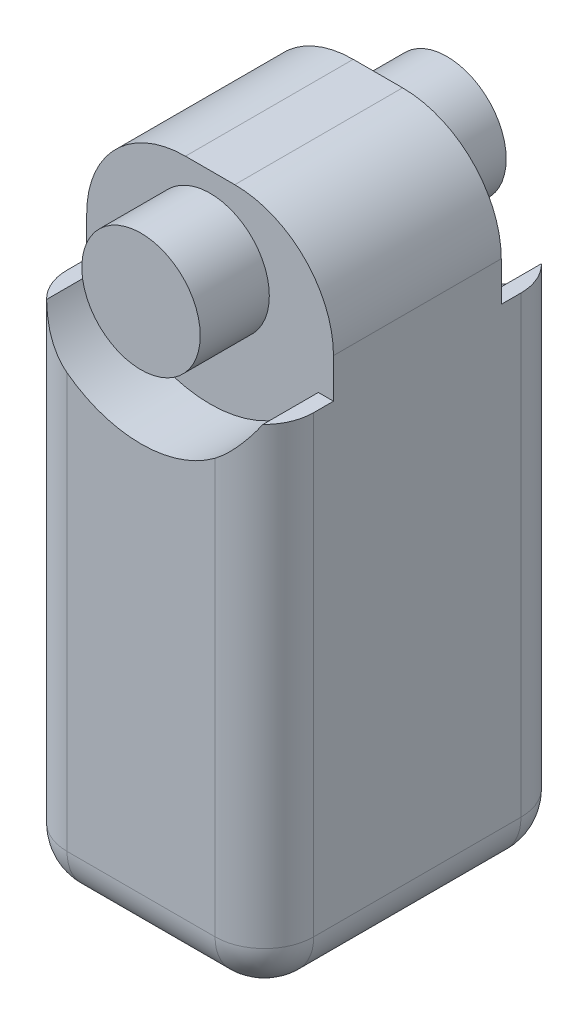
from build123d import *

# Parameters (mm, degrees)
CROQUIS1_W              = 25
CROQUIS1_H              = 65
SALIENTE_EXTRUIR1_DEPTH = 15.5
CROQUIS2_R              = 6
CORTAR_EXTRUIR1_DEPTH   = 7
REDONDEO1_R             = 10
REDONDEO2_R             = 5
CROQUIS3_R              = 5
CORTAR_EXTRUIR2_DEPTH   = 5.5
REDONDEO3_R             = 5


with BuildPart() as part:
    # Croquis1 → Saliente-Extruir1 (new, symmetric)
    with BuildSketch(Plane.XY):
        with Locations((10.230951989, -15.239848308)):
            Rectangle(CROQUIS1_W, CROQUIS1_H)
    extrude(amount=SALIENTE_EXTRUIR1_DEPTH, both=True)

    # Croquis2 → Cortar-Extruir1 (cut)
    with BuildSketch(Plane.XY.offset(15.5)):
        with BuildLine():
            Line((-2.269048011, 9.260151692), (-2.269048011, 26.058320898))
            Line((-2.269048011, 26.058320898), (22.730951989, 26.058320898))
            Line((22.730951989, 26.058320898), (22.730951989, 9.260151692))
            Line((22.730951989, 9.260151692), (22.730951989, 3.260151692))
            Line((22.730951989, 3.260151692), (21.196808088, 3.260151692))
            ThreePointArc((21.196808088, 3.260151692), (10.230951989, -3.239848308), (-0.734904111, 3.260151692))
            Line((-0.734904111, 3.260151692), (-2.269048011, 3.260151692))
            Line((-2.269048011, 3.260151692), (-2.269048011, 9.260151692))
        make_face()
        with Locations((10.230951989, 9.260151692)):
            Circle(CROQUIS2_R, mode=Mode.SUBTRACT)
    cortar_extruir1 = extrude(amount=-CORTAR_EXTRUIR1_DEPTH, mode=Mode.SUBTRACT)

    # Simetría1: Cortar-Extruir1 across plane
    add(cortar_extruir1.mirror(Plane.XY), mode=Mode.SUBTRACT)

    # Redondeo1
    redondeo1_edges = [part.edges().sort_by_distance(p)[0] for p in [
        (-2.269048011, 17.260151692, 0),
        (22.730951989, 17.260151692, 0),
    ]]
    fillet(redondeo1_edges, radius=REDONDEO1_R)

    # Redondeo2
    redondeo2_edges = [part.edges().sort_by_distance(p)[0] for p in [
        (22.730951989, -22.239848308, -15.5),
        (22.730951989, -22.239848308, 15.5),
        (-2.269048011, -22.239848308, 15.5),
        (-2.269048011, -22.239848308, -15.5),
    ]]
    fillet(redondeo2_edges, radius=REDONDEO2_R)

    # Croquis3 → Cortar-Extruir2 (cut)
    with BuildSketch(Plane.XZ.offset(47.739848308)):
        with Locations(Location((10.230951989, 0, 0), (0, 0, 270))):
            Circle(CROQUIS3_R)
    extrude(amount=-CORTAR_EXTRUIR2_DEPTH, mode=Mode.SUBTRACT)

    # Redondeo3
    redondeo3_edges = [part.edges().sort_by_distance(p)[0] for p in [
        (22.730951989, -47.739848308, 0),
        (10.230951989, -47.739848308, -15.5),
        (10.230951989, -47.739848308, 15.5),
        (-2.269048011, -47.739848308, 0),
        (-0.804581917, -47.739848308, -14.035533906),
        (-0.804581917, -47.739848308, 14.035533906),
        (21.266485895, -47.739848308, 14.035533906),
        (21.266485895, -47.739848308, -14.035533906),
    ]]
    fillet(redondeo3_edges, radius=REDONDEO3_R)


solid = part.part
